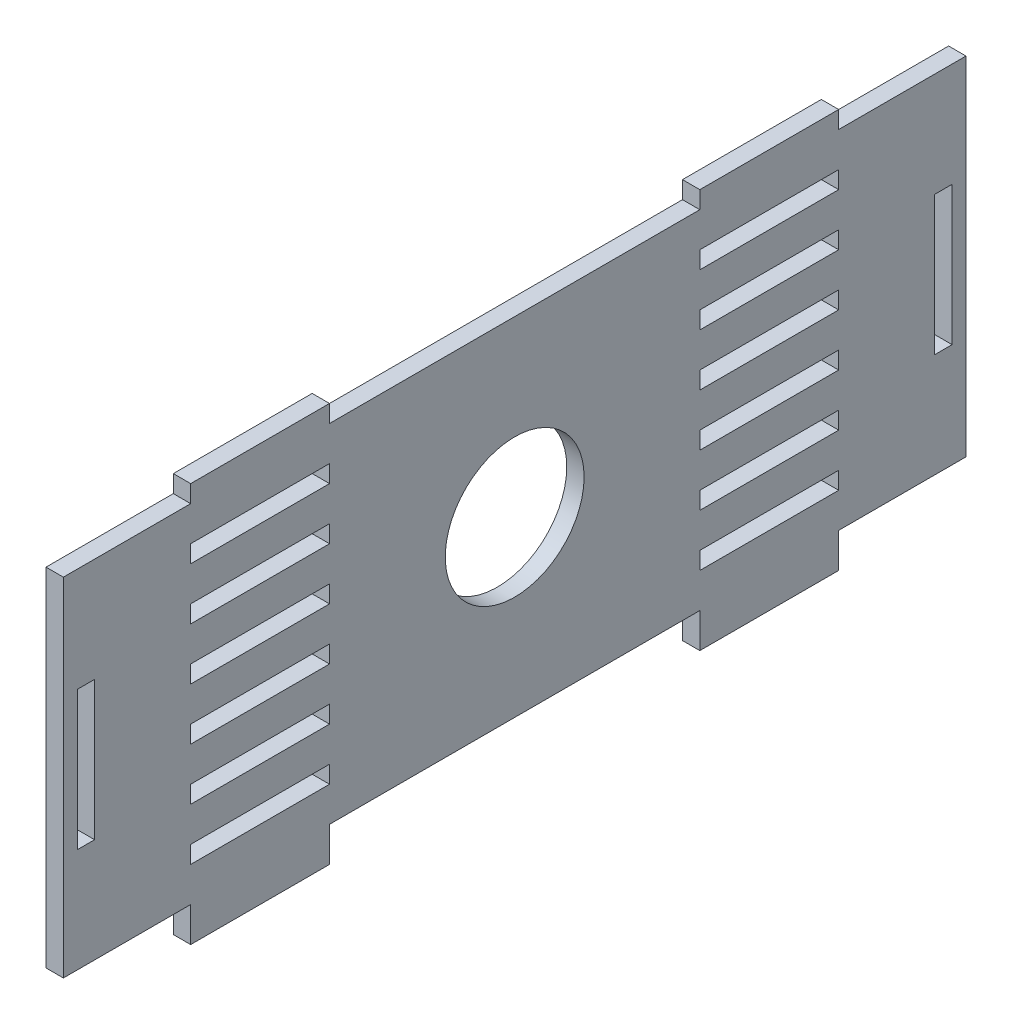
from build123d import *

# Parameters (mm, degrees)
SKETCH1_R           = 10
SKETCH1_W           = 2.5
SKETCH1_H           = 20
BOSS_EXTRUDE3_DEPTH = 1.25
SKETCH2_W           = 20
SKETCH2_H           = 2.5
CUT_EXTRUDE1_DEPTH  = 72.632743909


with BuildPart() as part:
    # Sketch1 → Boss-Extrude3 (new, symmetric)
    with BuildSketch(Plane(origin=(0, 0, 0), x_dir=(0, 0, -1), z_dir=(1, 0, 0))):
        Polygon((-46.666666667, -25), (-65, -25), (-65, 25), (-46.666666667, 25), (-46.666666667, 27.5), (-26.666666667, 27.5), (-26.666666667, 25), (26.666666667, 25), (26.666666667, 27.5), (46.666666667, 27.5), (46.666666667, 25), (65, 25), (65, -25), (46.666666667, -25), (46.666666667, -30), (26.666666667, -30), (26.666666667, -25), (-26.666666667, -25), (-26.666666667, -30), (-46.666666667, -30), align=None)
        Circle(SKETCH1_R, mode=Mode.SUBTRACT)
        with Locations((-61.75, 0)):
            Rectangle(SKETCH1_W, SKETCH1_H, mode=Mode.SUBTRACT)
        with Locations((61.75, 0)):
            Rectangle(SKETCH1_W, SKETCH1_H, mode=Mode.SUBTRACT)
    extrude(amount=BOSS_EXTRUDE3_DEPTH, both=True)

    # Sketch2 → Cut-Extrude1 (cut, through all)
    with BuildSketch(Plane(origin=(1.25, 0, 0), x_dir=(0, 0, -1), z_dir=(1, 0, 0))):
        with Locations((-36.666666667, 18.75)):
            Rectangle(SKETCH2_W, SKETCH2_H)
        with Locations((-36.666666667, 11.25)):
            Rectangle(SKETCH2_W, SKETCH2_H)
        with Locations((-36.666666667, 3.75)):
            Rectangle(SKETCH2_W, SKETCH2_H)
        with Locations((-36.666666667, -3.75)):
            Rectangle(SKETCH2_W, SKETCH2_H)
        with Locations((-36.666666667, -11.25)):
            Rectangle(SKETCH2_W, SKETCH2_H)
        with Locations((-36.666666667, -18.75)):
            Rectangle(SKETCH2_W, SKETCH2_H)
        with Locations((36.666666667, -18.75)):
            Rectangle(SKETCH2_W, SKETCH2_H)
        with Locations((36.666666667, -11.25)):
            Rectangle(SKETCH2_W, SKETCH2_H)
        with Locations((36.666666667, -3.75)):
            Rectangle(SKETCH2_W, SKETCH2_H)
        with Locations((36.666666667, 3.75)):
            Rectangle(SKETCH2_W, SKETCH2_H)
        with Locations((36.666666667, 11.25)):
            Rectangle(SKETCH2_W, SKETCH2_H)
        with Locations((36.666666667, 18.75)):
            Rectangle(SKETCH2_W, SKETCH2_H)
    extrude(amount=-CUT_EXTRUDE1_DEPTH, mode=Mode.SUBTRACT)


solid = part.part
